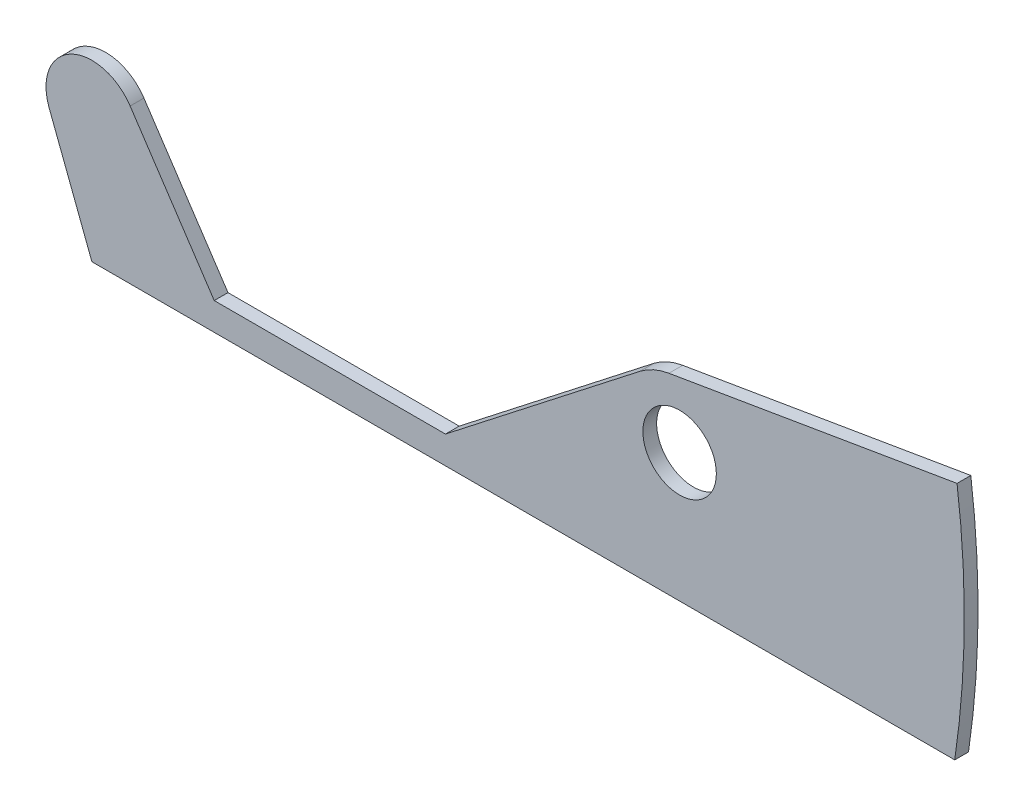
from build123d import *

# Parameters (mm, degrees)
SKETCH_1_R      = 8
EXTRUDE_1_DEPTH = 3


with BuildPart() as part:
    # Эскиз1 → Бобышка-Вытянуть1 (new body)
    with BuildSketch(Plane.XY):
        with BuildLine():
            Line((-9.340497736, -3.571428571), (0, -28))
            Line((0, -28), (187.92551716, -28))
            ThreePointArc((187.92551716, -28), (189.991352408, -1.812735596), (188.425560886, 24.409178696))
            Line((188.425560886, 24.409178696), (125.667350293, 13.804301697))
            ThreePointArc((125.667350293, 13.804301697), (122.358795725, 12.813150055), (119.393575063, 11.042166898))
            Line((119.393575063, 11.042166898), (77, -22))
            Line((77, -22), (26.641557218, -22))
            Line((26.641557218, -22), (8.326583423, 5.537870395))
            ThreePointArc((8.326583423, 5.537870395), (-4.582776175, 8.888091051), (-9.340497736, -3.571428571))
        make_face()
        with Locations((128, 0)):
            Circle(SKETCH_1_R, mode=Mode.SUBTRACT)
    extrude(amount=EXTRUDE_1_DEPTH)


solid = part.part
